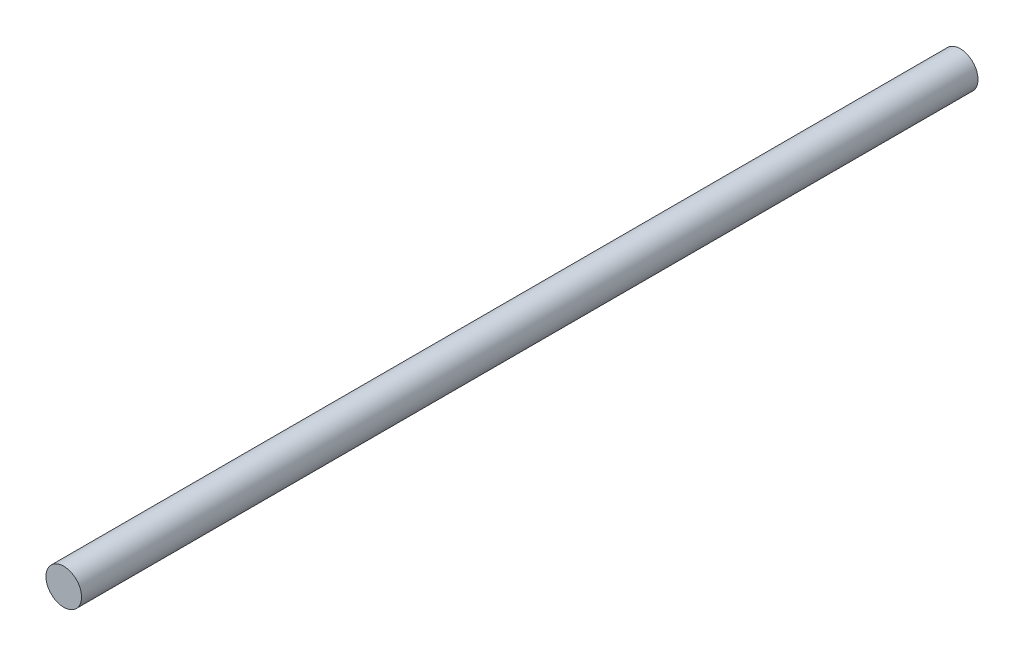
from build123d import *

# Parameters (mm, degrees)
SKETCH1_R           = 0.79375
BOSS_EXTRUDE1_DEPTH = 40


with BuildPart() as part:
    # Sketch1 → Boss-Extrude1 (new body)
    with BuildSketch(Plane.XY):
        Circle(SKETCH1_R)
    extrude(amount=BOSS_EXTRUDE1_DEPTH)


solid = part.part
